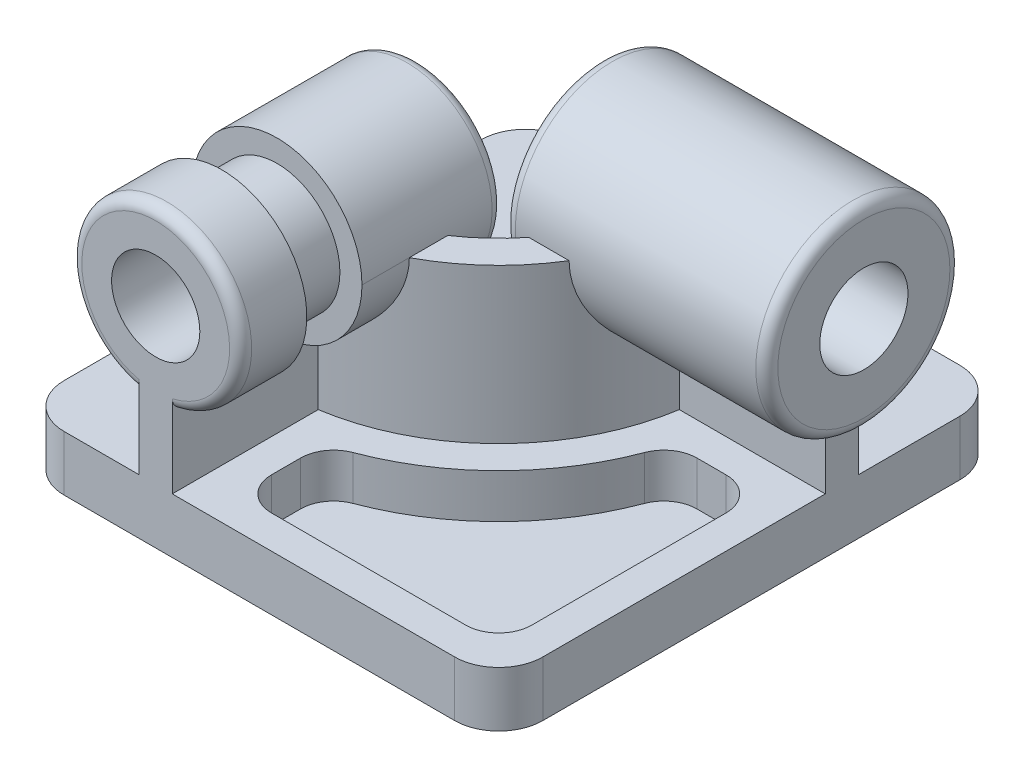
from build123d import *

# Parameters (mm, degrees)
BOSS_EXTRUDE1_DEPTH        = 5
BOSS_EXTRUDE2_DEPTH        = 25
BOSS_EXTRUDE3_DEPTH        = 95
BOSS_EXTRUDE4_DEPTH        = 25
BOSS_EXTRUDE5_DEPTH        = 10
BOSS_EXTRUDE5_DEPTH_BACK   = 109
SKETCH2_R                  = 44
BOSS_EXTRUDE6_DEPTH        = 119
SKETCH4_3_R                = 38.5
SKETCH4_3_R_2              = 28.5
CUT_EXTRUDE1_DEPTH         = 55
SKETCH4_4_R                = 38.5
SKETCH4_4_R_2              = 28.5
BOSS_EXTRUDE7_DEPTH        = 30
F_0_15_40_DIAMETER_HOLE2_D = 40
F_0_15_40_DIAMETER_HOLE1_D = 40
FILLET1_R                  = 5


with BuildPart() as part:
    # Sketch1 → Boss-Extrude1 (new body)
    with BuildSketch(Plane(origin=(0, 0, 0), x_dir=(1, 0, 0), z_dir=(0, 1, 0))):
        with BuildLine():
            Line((30, 30), (30, 43.170955107))
            ThreePointArc((30, 43.170955107), (32.669112714, 51.711986587), (39.7265625, 57.213421305))
            ThreePointArc((39.7265625, 57.213421305), (79.903066274, 83.096933726), (105.786578695, 123.2734375))
            ThreePointArc((105.786578695, 123.2734375), (111.288013413, 130.330887286), (119.829044893, 133))
            Line((119.829044893, 133), (133, 133))
            ThreePointArc((133, 133), (143.606601718, 128.606601718), (148, 118))
            Line((148, 118), (148, 30))
            ThreePointArc((148, 30), (143.606601718, 19.393398282), (133, 15))
            Line((133, 15), (45, 15))
            ThreePointArc((45, 15), (34.393398282, 19.393398282), (30, 30))
        make_face()
    extrude(amount=BOSS_EXTRUDE1_DEPTH)

    # Sketch1<3> → Boss-Extrude2 (add)
    with BuildSketch(Plane(origin=(0, 0, 0), x_dir=(1, 0, 0), z_dir=(0, 1, 0))):
        with BuildLine():
            Line((15, 66.154762636), (15, 15))
            Line((15, 15), (15, 0))
            Line((15, 0), (143, 0))
            ThreePointArc((143, 0), (157.142135624, 5.857864376), (163, 20))
            Line((163, 20), (163, 148))
            Line((163, 148), (148, 148))
            Line((148, 148), (96.845237364, 148))
            ThreePointArc((96.845237364, 148), (69.296464556, 93.703535444), (15, 66.154762636))
        make_face()
        with BuildLine():
            ThreePointArc((45, 15), (34.393398282, 19.393398282), (30, 30))
            Line((30, 30), (30, 43.170955107))
            ThreePointArc((30, 43.170955107), (32.669112714, 51.711986587), (39.7265625, 57.213421305))
            ThreePointArc((39.7265625, 57.213421305), (79.903066274, 83.096933726), (105.786578695, 123.2734375))
            ThreePointArc((105.786578695, 123.2734375), (111.288013413, 130.330887286), (119.829044893, 133))
            Line((119.829044893, 133), (133, 133))
            ThreePointArc((133, 133), (143.606601718, 128.606601718), (148, 118))
            Line((148, 118), (148, 30))
            ThreePointArc((148, 30), (143.606601718, 19.393398282), (133, 15))
            Line((133, 15), (45, 15))
        make_face(mode=Mode.SUBTRACT)
    extrude(amount=BOSS_EXTRUDE2_DEPTH)

    # Sketch1<4> → Boss-Extrude3 (add)
    with BuildSketch(Plane(origin=(0, 0, 0), x_dir=(1, 0, 0), z_dir=(0, 1, 0))):
        with BuildLine():
            Line((15, 0), (15, 15))
            Line((15, 15), (15, 66.154762636))
            ThreePointArc((15, 66.154762636), (69.296464556, 93.703535444), (96.845237364, 148))
            Line((96.845237364, 148), (148, 148))
            Line((148, 148), (163, 148))
            Line((163, 148), (163, 163))
            Line((163, 163), (83, 163))
            ThreePointArc((83, 163), (58.689862838, 104.310137162), (0, 80))
            Line((0, 80), (0, 0))
            Line((0, 0), (15, 0))
        make_face()
    extrude(amount=BOSS_EXTRUDE3_DEPTH)

    # Sketch1<5> → Boss-Extrude4 (add)
    with BuildSketch(Plane(origin=(0, 0, 0), x_dir=(1, 0, 0), z_dir=(0, 1, 0))):
        with BuildLine():
            Line((-34, 0), (0, 0))
            Line((0, 0), (0, 80))
            ThreePointArc((0, 80), (58.689862838, 104.310137162), (83, 163))
            Line((83, 163), (163, 163))
            Line((163, 163), (163, 209))
            ThreePointArc((163, 209), (157.142135624, 223.142135624), (143, 229))
            Line((143, 229), (-34, 229))
            ThreePointArc((-34, 229), (-48.142135624, 223.142135624), (-54, 209))
            Line((-54, 209), (-54, 20))
            ThreePointArc((-54, 20), (-48.142135624, 5.857864376), (-34, 0))
        make_face()
    extrude(amount=BOSS_EXTRUDE4_DEPTH)

    # Sketch2 → Boss-Extrude5 (add, two sides: drawn at the far end of the back side and taken through both)
    with BuildSketch(Plane(origin=(163, 0, 0), x_dir=(0, 0, -1), z_dir=(1, 0, 0)).offset(-BOSS_EXTRUDE5_DEPTH_BACK)):
        with Locations((155.5, 95)):
            Circle(SKETCH2_R)
    extrude(amount=BOSS_EXTRUDE5_DEPTH + BOSS_EXTRUDE5_DEPTH_BACK)

    # Sketch4 → Boss-Extrude6 (add)
    with BuildSketch(Plane.XY):
        with BuildLine():
            Line((0, 95), (0, 67.50454583))
            ThreePointArc((0, 67.50454583), (7.5, 66.5), (15, 67.50454583))
            Line((15, 67.50454583), (15, 95))
            Line((15, 95), (0, 95))
        make_face()
        with BuildLine():
            ThreePointArc((36, 95), (-9.798843892, 117.649503306), (0, 67.50454583))
            Line((0, 67.50454583), (0, 95))
            Line((0, 95), (15, 95))
            Line((15, 95), (15, 67.50454583))
            ThreePointArc((15, 67.50454583), (30.149503306, 77.701156108), (36, 95))
        make_face()
        with BuildLine():
            ThreePointArc((15, 57.237584823), (37.257352033, 70.571532999), (46, 95))
            ThreePointArc((46, 95), (-16.928467001, 124.757352033), (0, 57.237584823))
            Line((0, 57.237584823), (0, 67.50454583))
            ThreePointArc((0, 67.50454583), (-9.798843892, 117.649503306), (36, 95))
            ThreePointArc((36, 95), (30.149503306, 77.701156108), (15, 67.50454583))
            Line((15, 67.50454583), (15, 57.237584823))
        make_face()
        with BuildLine():
            Line((0, 67.50454583), (0, 57.237584823))
            ThreePointArc((0, 57.237584823), (7.5, 56.5), (15, 57.237584823))
            Line((15, 57.237584823), (15, 67.50454583))
            ThreePointArc((15, 67.50454583), (7.5, 66.5), (0, 67.50454583))
        make_face()
        with BuildLine():
            Line((0, 95), (0, 67.50454583))
            ThreePointArc((0, 67.50454583), (7.5, 66.5), (15, 67.50454583))
            Line((15, 67.50454583), (15, 95))
            Line((15, 95), (0, 95))
        make_face()
        with BuildLine():
            ThreePointArc((36, 95), (-9.798843892, 117.649503306), (0, 67.50454583))
            Line((0, 67.50454583), (0, 95))
            Line((0, 95), (15, 95))
            Line((15, 95), (15, 67.50454583))
            ThreePointArc((15, 67.50454583), (30.149503306, 77.701156108), (36, 95))
        make_face()
        with BuildLine():
            ThreePointArc((15, 57.237584823), (37.257352033, 70.571532999), (46, 95))
            ThreePointArc((46, 95), (-16.928467001, 124.757352033), (0, 57.237584823))
            Line((0, 57.237584823), (0, 67.50454583))
            ThreePointArc((0, 67.50454583), (-9.798843892, 117.649503306), (36, 95))
            ThreePointArc((36, 95), (30.149503306, 77.701156108), (15, 67.50454583))
            Line((15, 67.50454583), (15, 57.237584823))
        make_face()
        with BuildLine():
            Line((0, 67.50454583), (0, 57.237584823))
            ThreePointArc((0, 57.237584823), (7.5, 56.5), (15, 57.237584823))
            Line((15, 57.237584823), (15, 67.50454583))
            ThreePointArc((15, 67.50454583), (7.5, 66.5), (0, 67.50454583))
        make_face()
    extrude(amount=-BOSS_EXTRUDE6_DEPTH)

    # Sketch4<3> → Cut-Extrude1 (cut)
    with BuildSketch(Plane.XY):
        with Locations((7.5, 95)):
            Circle(SKETCH4_3_R)
        with Locations((7.5, 95)):
            Circle(SKETCH4_3_R_2, mode=Mode.SUBTRACT)
    extrude(amount=-CUT_EXTRUDE1_DEPTH, mode=Mode.SUBTRACT)

    # Sketch4<4> → Boss-Extrude7 (add)
    with BuildSketch(Plane.XY):
        with Locations((7.5, 95)):
            Circle(SKETCH4_4_R)
        with Locations((7.5, 95)):
            Circle(SKETCH4_4_R_2, mode=Mode.SUBTRACT)
    extrude(amount=-BOSS_EXTRUDE7_DEPTH)

    # Ø0.15 (40) Diameter Hole2 (through all)
    with Locations(Plane(origin=(7.5, 95, 0), x_dir=(1, 0, 0), z_dir=(0, 0, 1))):
        with Locations((0, 0)):
            Hole(F_0_15_40_DIAMETER_HOLE2_D / 2)

    # Ø0.15 (40) Diameter Hole1 (through all)
    with Locations(Plane(origin=(173, 95, -155.5), x_dir=(0, 0, 1), z_dir=(1, 0, 0))):
        with Locations((0, 0)):
            Hole(F_0_15_40_DIAMETER_HOLE1_D / 2)

    # Fillet1
    fillet1_edges = [part.edges().sort_by_distance(p)[0] for p in [
        (54, 95, -111.5),
        (173, 95, -111.5),
        (15, 132.762415177, -119),
        (7.5, 133.5, 0),
    ]]
    fillet(fillet1_edges, radius=FILLET1_R)


solid = part.part
